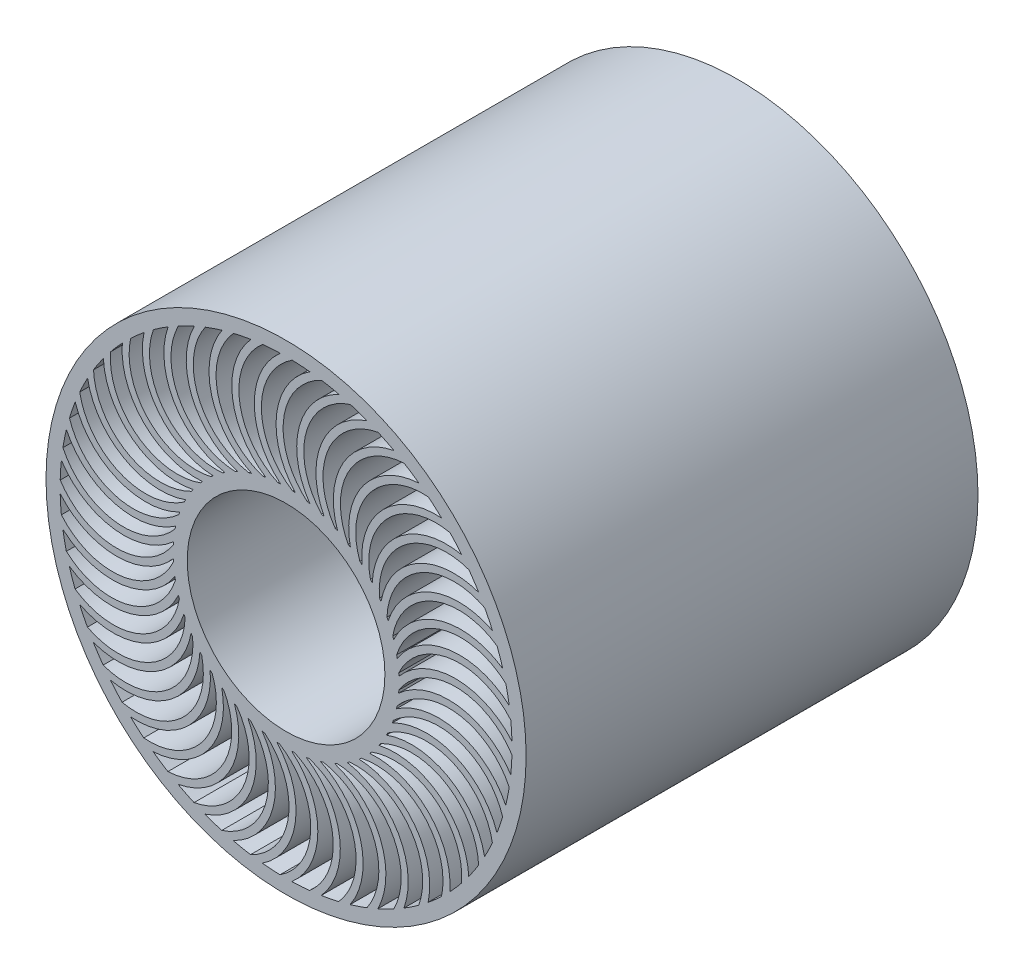
from build123d import *

# Parameters (mm, degrees)
SKETCH1_R           = 107.95
SKETCH1_R_2         = 44.45
BOSS_EXTRUDE1_DEPTH = 203.2


with BuildPart() as part:
    # Sketch1 → Boss-Extrude1 (new body)
    with BuildSketch(Plane.XY):
        Circle(SKETCH1_R)
        with BuildLine():
            ThreePointArc((2.914031468, 50.716352596), (-11.111338955, 76.088304157), (2.725745464, 101.563429992))
            ThreePointArc((2.725745464, 101.563429992), (6.717370348, 101.377694468), (10.698604394, 101.035141728))
            ThreePointArc((10.698604394, 101.035141728), (-4.227519557, 77.34168725), (4.172805013, 50.62832901))
            ThreePointArc((4.172805013, 50.62832901), (3.543691559, 50.676249369), (2.914031468, 50.716352596))
        make_face(mode=Mode.SUBTRACT)
        with BuildLine():
            ThreePointArc((-2.58065598, 101.567220178), (-14.286468478, 76.128216363), (-2.471216917, 50.739856986))
            ThreePointArc((-2.471216917, 50.739856986), (-3.10120308, 50.705251596), (-3.730710863, 50.6628246))
            ThreePointArc((-3.730710863, 50.6628246), (-20.947796524, 73.987037403), (-10.554261452, 101.050321945))
            ThreePointArc((-10.554261452, 101.050321945), (-6.572542121, 101.387187011), (-2.58065598, 101.567220178))
        make_face(mode=Mode.SUBTRACT)
        with BuildLine():
            ThreePointArc((-15.815760615, 100.361455331), (-24.100971962, 73.612170588), (-9.07295564, 49.983211941))
            ThreePointArc((-9.07295564, 49.983211941), (-9.693035274, 49.866672911), (-10.311619697, 49.742441629))
            ThreePointArc((-10.311619697, 49.742441629), (-30.425831487, 70.619831925), (-23.653682028, 98.808214874))
            ThreePointArc((-23.653682028, 98.808214874), (-19.749996573, 99.661916675), (-15.815760615, 100.361455331))
        make_face(mode=Mode.SUBTRACT)
        with BuildLine():
            ThreePointArc((-28.7802532, 97.438478158), (-33.503101134, 69.836600165), (-15.519453576, 48.371340282))
            ThreePointArc((-15.519453576, 48.371340282), (-16.119016947, 48.174861626), (-16.716093858, 47.970951691))
            ThreePointArc((-16.716093858, 47.970951691), (-39.383272037, 66.044301544), (-36.348381547, 94.875471851))
            ThreePointArc((-36.348381547, 94.875471851), (-32.589523107, 96.231403313), (-28.7802532, 97.438478158))
        make_face(mode=Mode.SUBTRACT)
        with BuildLine():
            ThreePointArc((-41.252307674, 92.848301608), (-42.331982957, 64.866106151), (-21.700409359, 45.93182158))
            ThreePointArc((-21.700409359, 45.93182158), (-22.269197772, 45.658765102), (-22.834551019, 45.378665469))
            ThreePointArc((-22.834551019, 45.378665469), (-47.666853884, 60.338734853), (-48.42115018, 89.3193832))
            ThreePointArc((-48.42115018, 89.3193832), (-44.871433866, 91.15434396), (-41.252307674, 92.848301608))
        make_face(mode=Mode.SUBTRACT)
        with BuildLine():
            ThreePointArc((-53.018523726, 86.669464876), (-50.436552814, 58.785735076), (-27.510065121, 42.706396676))
            ThreePointArc((-27.510065121, 42.706396676), (-28.038346448, 42.361434448), (-28.562302682, 42.0099377))
            ThreePointArc((-28.562302682, 42.0099377), (-55.134842645, 53.600755679), (-59.665419508, 82.235015139))
            ThreePointArc((-59.665419508, 82.235015139), (-56.38558195, 84.51760851), (-53.018523726, 86.669464876))
        make_face(mode=Mode.SUBTRACT)
        with BuildLine():
            ThreePointArc((-63.877578138, 79.00768957), (-57.678139269, 51.699523776), (-32.849016042, 38.750253484))
            ThreePointArc((-32.849016042, 38.750253484), (-33.327751243, 38.339287906), (-33.801345426, 37.922408249))
            ThreePointArc((-33.801345426, 37.922408249), (-61.659458962, 45.945652715), (-69.888796966, 73.743583169))
            ThreePointArc((-69.888796966, 73.743583169), (-66.934957094, 76.434753344), (-63.877578138, 79.00768957))
        make_face(mode=Mode.SUBTRACT)
        with BuildLine():
            ThreePointArc((-73.643669478, 69.994070791), (-63.93283677, 43.72871929), (-37.625911191, 34.131082711))
            ThreePointArc((-37.625911191, 34.131082711), (-38.046908973, 33.661145518), (-38.462037779, 33.186015879))
            ThreePointArc((-38.462037779, 33.186015879), (-67.129064841, 37.504406894), (-78.916357732, 63.990378045))
            ThreePointArc((-78.916357732, 63.990378045), (-76.339056565, 67.044078358), (-73.643669478, 69.994070791))
        make_face(mode=Mode.SUBTRACT)
        with BuildLine():
            ThreePointArc((-82.149697215, 59.782834054), (-69.093625709, 35.009704293), (-41.759016567, 28.927919651))
            ThreePointArc((-41.759016567, 28.927919651), (-42.115073543, 28.407051598), (-42.464634001, 27.881801576))
            ThreePointArc((-42.464634001, 27.881801576), (-71.450073808, 28.421450273), (-86.593637736, 53.142279812))
            ThreePointArc((-86.593637736, 53.142279812), (-84.436973612, 56.506260602), (-82.149697215, 59.782834054))
        make_face(mode=Mode.SUBTRACT)
        with BuildLine():
            ThreePointArc((-89.250120856, 48.548696452), (-73.072203555, 25.691663549), (-45.177613593, 23.229791865))
            ThreePointArc((-45.177613593, 23.229791865), (-45.462637528, 22.666905149), (-45.740648563, 22.100521919))
            ThreePointArc((-45.740648563, 22.100521919), (-74.548552204, 18.852194758), (-92.789276591, 41.384902437))
            ThreePointArc((-92.789276591, 41.384902437), (-91.090150631, 45.001605061), (-89.250120856, 48.548696452))
        make_face(mode=Mode.SUBTRACT)
        with BuildLine():
            ThreePointArc((-94.823450185, 36.483877193), (-75.800495738, 15.934031319), (-47.823209124, 17.134195899))
            ThreePointArc((-47.823209124, 17.134195899), (-48.03232318, 16.538921668), (-48.234027945, 15.941096203))
            ThreePointArc((-48.234027945, 15.941096203), (-76.371484202, 8.960372964), (-97.397265197, 28.919417907))
            ThreePointArc((-97.397265197, 28.919417907), (-96.184749917, 32.726959581), (-94.823450185, 36.483877193))
        make_face(mode=Mode.SUBTRACT)
        with BuildLine():
            ThreePointArc((-98.774323991, 23.79480868), (-77.231820424, 5.903763395), (-49.650536288, 10.745429091))
            ThreePointArc((-49.650536288, 10.745429091), (-49.780162465, 10.127952652), (-49.902109737, 9.508913912))
            ThreePointArc((-49.902109737, 9.508913912), (-76.887678931, -1.084763296), (-100.338759592, 15.959114119))
            ThreePointArc((-100.338759592, 15.959114119), (-99.633601465, 19.892346749), (-98.774323991, 23.79480868))
        make_face(mode=Mode.SUBTRACT)
        with BuildLine():
            ThreePointArc((-101.035141728, 10.698604394), (-77.34168725, -4.227519557), (-50.62832901, 4.172805013))
            ThreePointArc((-50.62832901, 4.172805013), (-50.676249369, 3.543691559), (-50.716352596, 2.914031468))
            ThreePointArc((-50.716352596, 2.914031468), (-76.088304157, -11.111338955), (-101.563429992, 2.725745464))
            ThreePointArc((-101.563429992, 2.725745464), (-101.377694468, 6.717370348), (-101.035141728, 10.698604394))
        make_face(mode=Mode.SUBTRACT)
        with BuildLine():
            ThreePointArc((-101.567220178, -2.58065598), (-76.128216363, -14.286468478), (-50.739856986, -2.471216917))
            ThreePointArc((-50.739856986, -2.471216917), (-50.705251596, -3.10120308), (-50.6628246, -3.730710863))
            ThreePointArc((-50.6628246, -3.730710863), (-73.987037403, -20.947796524), (-101.050321945, -10.554261452))
            ThreePointArc((-101.050321945, -10.554261452), (-101.387187011, -6.572542121), (-101.567220178, -2.58065598))
        make_face(mode=Mode.SUBTRACT)
        with BuildLine():
            ThreePointArc((-100.361455331, -15.815760615), (-73.612170588, -24.100971962), (-49.983211941, -9.07295564))
            ThreePointArc((-49.983211941, -9.07295564), (-49.866672911, -9.693035274), (-49.742441629, -10.311619697))
            ThreePointArc((-49.742441629, -10.311619697), (-70.619831925, -30.425831487), (-98.808214874, -23.653682028))
            ThreePointArc((-98.808214874, -23.653682028), (-99.661916675, -19.749996573), (-100.361455331, -15.815760615))
        make_face(mode=Mode.SUBTRACT)
        with BuildLine():
            ThreePointArc((-97.438478158, -28.7802532), (-69.836600165, -33.503101134), (-48.371340282, -15.519453576))
            ThreePointArc((-48.371340282, -15.519453576), (-48.174861626, -16.119016947), (-47.970951691, -16.716093858))
            ThreePointArc((-47.970951691, -16.716093858), (-66.044301544, -39.383272037), (-94.875471851, -36.348381547))
            ThreePointArc((-94.875471851, -36.348381547), (-96.231403313, -32.589523107), (-97.438478158, -28.7802532))
        make_face(mode=Mode.SUBTRACT)
        with BuildLine():
            ThreePointArc((-92.848301608, -41.252307674), (-64.866106151, -42.331982957), (-45.93182158, -21.700409359))
            ThreePointArc((-45.93182158, -21.700409359), (-45.658765102, -22.269197772), (-45.378665469, -22.834551019))
            ThreePointArc((-45.378665469, -22.834551019), (-60.338734853, -47.666853884), (-89.3193832, -48.42115018))
            ThreePointArc((-89.3193832, -48.42115018), (-91.15434396, -44.871433866), (-92.848301608, -41.252307674))
        make_face(mode=Mode.SUBTRACT)
        with BuildLine():
            ThreePointArc((-86.669464876, -53.018523726), (-58.785735076, -50.436552814), (-42.706396676, -27.510065121))
            ThreePointArc((-42.706396676, -27.510065121), (-42.361434448, -28.038346448), (-42.0099377, -28.562302682))
            ThreePointArc((-42.0099377, -28.562302682), (-53.600755679, -55.134842645), (-82.235015139, -59.665419508))
            ThreePointArc((-82.235015139, -59.665419508), (-84.51760851, -56.38558195), (-86.669464876, -53.018523726))
        make_face(mode=Mode.SUBTRACT)
        with BuildLine():
            ThreePointArc((-79.00768957, -63.877578138), (-51.699523776, -57.678139269), (-38.750253484, -32.849016042))
            ThreePointArc((-38.750253484, -32.849016042), (-38.339287906, -33.327751243), (-37.922408249, -33.801345426))
            ThreePointArc((-37.922408249, -33.801345426), (-45.945652715, -61.659458962), (-73.743583169, -69.888796966))
            ThreePointArc((-73.743583169, -69.888796966), (-76.434753344, -66.934957094), (-79.00768957, -63.877578138))
        make_face(mode=Mode.SUBTRACT)
        with BuildLine():
            ThreePointArc((-69.994070791, -73.643669478), (-43.72871929, -63.93283677), (-34.131082711, -37.625911191))
            ThreePointArc((-34.131082711, -37.625911191), (-33.661145518, -38.046908973), (-33.186015879, -38.462037779))
            ThreePointArc((-33.186015879, -38.462037779), (-37.504406894, -67.129064841), (-63.990378045, -78.916357732))
            ThreePointArc((-63.990378045, -78.916357732), (-67.044078358, -76.339056565), (-69.994070791, -73.643669478))
        make_face(mode=Mode.SUBTRACT)
        with BuildLine():
            ThreePointArc((-59.782834054, -82.149697215), (-35.009704293, -69.093625709), (-28.927919651, -41.759016567))
            ThreePointArc((-28.927919651, -41.759016567), (-28.407051598, -42.115073543), (-27.881801576, -42.464634001))
            ThreePointArc((-27.881801576, -42.464634001), (-28.421450273, -71.450073808), (-53.142279812, -86.593637736))
            ThreePointArc((-53.142279812, -86.593637736), (-56.506260602, -84.436973612), (-59.782834054, -82.149697215))
        make_face(mode=Mode.SUBTRACT)
        with BuildLine():
            ThreePointArc((-48.548696452, -89.250120856), (-25.691663549, -73.072203555), (-23.229791865, -45.177613593))
            ThreePointArc((-23.229791865, -45.177613593), (-22.666905149, -45.462637528), (-22.100521919, -45.740648563))
            ThreePointArc((-22.100521919, -45.740648563), (-18.852194758, -74.548552204), (-41.384902437, -92.789276591))
            ThreePointArc((-41.384902437, -92.789276591), (-45.001605061, -91.090150631), (-48.548696452, -89.250120856))
        make_face(mode=Mode.SUBTRACT)
        with BuildLine():
            ThreePointArc((-36.483877193, -94.823450185), (-15.934031319, -75.800495738), (-17.134195899, -47.823209124))
            ThreePointArc((-17.134195899, -47.823209124), (-16.538921668, -48.03232318), (-15.941096203, -48.234027945))
            ThreePointArc((-15.941096203, -48.234027945), (-8.960372964, -76.371484202), (-28.919417907, -97.397265197))
            ThreePointArc((-28.919417907, -97.397265197), (-32.726959581, -96.184749917), (-36.483877193, -94.823450185))
        make_face(mode=Mode.SUBTRACT)
        with BuildLine():
            ThreePointArc((-23.79480868, -98.774323991), (-5.903763395, -77.231820424), (-10.745429091, -49.650536288))
            ThreePointArc((-10.745429091, -49.650536288), (-10.127952652, -49.780162465), (-9.508913912, -49.902109737))
            ThreePointArc((-9.508913912, -49.902109737), (1.084763296, -76.887678931), (-15.959114119, -100.338759592))
            ThreePointArc((-15.959114119, -100.338759592), (-19.892346749, -99.633601465), (-23.79480868, -98.774323991))
        make_face(mode=Mode.SUBTRACT)
        with BuildLine():
            ThreePointArc((-10.698604394, -101.035141728), (4.227519557, -77.34168725), (-4.172805013, -50.62832901))
            ThreePointArc((-4.172805013, -50.62832901), (-3.543691559, -50.676249369), (-2.914031468, -50.716352596))
            ThreePointArc((-2.914031468, -50.716352596), (11.111338955, -76.088304157), (-2.725745464, -101.563429992))
            ThreePointArc((-2.725745464, -101.563429992), (-6.717370348, -101.377694468), (-10.698604394, -101.035141728))
        make_face(mode=Mode.SUBTRACT)
        with BuildLine():
            ThreePointArc((2.58065598, -101.567220178), (14.286468478, -76.128216363), (2.471216917, -50.739856986))
            ThreePointArc((2.471216917, -50.739856986), (3.10120308, -50.705251596), (3.730710863, -50.6628246))
            ThreePointArc((3.730710863, -50.6628246), (20.947796524, -73.987037403), (10.554261452, -101.050321945))
            ThreePointArc((10.554261452, -101.050321945), (6.572542121, -101.387187011), (2.58065598, -101.567220178))
        make_face(mode=Mode.SUBTRACT)
        with BuildLine():
            ThreePointArc((15.815760615, -100.361455331), (24.100971962, -73.612170588), (9.07295564, -49.983211941))
            ThreePointArc((9.07295564, -49.983211941), (9.693035274, -49.866672911), (10.311619697, -49.742441629))
            ThreePointArc((10.311619697, -49.742441629), (30.425831487, -70.619831925), (23.653682028, -98.808214874))
            ThreePointArc((23.653682028, -98.808214874), (19.749996573, -99.661916675), (15.815760615, -100.361455331))
        make_face(mode=Mode.SUBTRACT)
        with BuildLine():
            ThreePointArc((28.7802532, -97.438478158), (33.503101134, -69.836600165), (15.519453576, -48.371340282))
            ThreePointArc((15.519453576, -48.371340282), (16.119016947, -48.174861626), (16.716093858, -47.970951691))
            ThreePointArc((16.716093858, -47.970951691), (39.383272037, -66.044301544), (36.348381547, -94.875471851))
            ThreePointArc((36.348381547, -94.875471851), (32.589523107, -96.231403313), (28.7802532, -97.438478158))
        make_face(mode=Mode.SUBTRACT)
        with BuildLine():
            ThreePointArc((41.252307674, -92.848301608), (42.331982957, -64.866106151), (21.700409359, -45.93182158))
            ThreePointArc((21.700409359, -45.93182158), (22.269197772, -45.658765102), (22.834551019, -45.378665469))
            ThreePointArc((22.834551019, -45.378665469), (47.666853884, -60.338734853), (48.42115018, -89.3193832))
            ThreePointArc((48.42115018, -89.3193832), (44.871433866, -91.15434396), (41.252307674, -92.848301608))
        make_face(mode=Mode.SUBTRACT)
        with BuildLine():
            ThreePointArc((53.018523726, -86.669464876), (50.436552814, -58.785735076), (27.510065121, -42.706396676))
            ThreePointArc((27.510065121, -42.706396676), (28.038346448, -42.361434448), (28.562302682, -42.0099377))
            ThreePointArc((28.562302682, -42.0099377), (55.134842645, -53.600755679), (59.665419508, -82.235015139))
            ThreePointArc((59.665419508, -82.235015139), (56.38558195, -84.51760851), (53.018523726, -86.669464876))
        make_face(mode=Mode.SUBTRACT)
        with BuildLine():
            ThreePointArc((63.877578138, -79.00768957), (57.678139269, -51.699523776), (32.849016042, -38.750253484))
            ThreePointArc((32.849016042, -38.750253484), (33.327751243, -38.339287906), (33.801345426, -37.922408249))
            ThreePointArc((33.801345426, -37.922408249), (61.659458962, -45.945652715), (69.888796966, -73.743583169))
            ThreePointArc((69.888796966, -73.743583169), (66.934957094, -76.434753344), (63.877578138, -79.00768957))
        make_face(mode=Mode.SUBTRACT)
        with BuildLine():
            ThreePointArc((73.643669478, -69.994070791), (63.93283677, -43.72871929), (37.625911191, -34.131082711))
            ThreePointArc((37.625911191, -34.131082711), (38.046908973, -33.661145518), (38.462037779, -33.186015879))
            ThreePointArc((38.462037779, -33.186015879), (67.129064841, -37.504406894), (78.916357732, -63.990378045))
            ThreePointArc((78.916357732, -63.990378045), (76.339056565, -67.044078358), (73.643669478, -69.994070791))
        make_face(mode=Mode.SUBTRACT)
        with BuildLine():
            ThreePointArc((82.149697215, -59.782834054), (69.093625709, -35.009704293), (41.759016567, -28.927919651))
            ThreePointArc((41.759016567, -28.927919651), (42.115073543, -28.407051598), (42.464634001, -27.881801576))
            ThreePointArc((42.464634001, -27.881801576), (71.450073808, -28.421450273), (86.593637736, -53.142279812))
            ThreePointArc((86.593637736, -53.142279812), (84.436973612, -56.506260602), (82.149697215, -59.782834054))
        make_face(mode=Mode.SUBTRACT)
        with BuildLine():
            ThreePointArc((89.250120856, -48.548696452), (73.072203555, -25.691663549), (45.177613593, -23.229791865))
            ThreePointArc((45.177613593, -23.229791865), (45.462637528, -22.666905149), (45.740648563, -22.100521919))
            ThreePointArc((45.740648563, -22.100521919), (74.548552204, -18.852194758), (92.789276591, -41.384902437))
            ThreePointArc((92.789276591, -41.384902437), (91.090150631, -45.001605061), (89.250120856, -48.548696452))
        make_face(mode=Mode.SUBTRACT)
        with BuildLine():
            ThreePointArc((94.823450185, -36.483877193), (75.800495738, -15.934031319), (47.823209124, -17.134195899))
            ThreePointArc((47.823209124, -17.134195899), (48.03232318, -16.538921668), (48.234027945, -15.941096203))
            ThreePointArc((48.234027945, -15.941096203), (76.371484202, -8.960372964), (97.397265197, -28.919417907))
            ThreePointArc((97.397265197, -28.919417907), (96.184749917, -32.726959581), (94.823450185, -36.483877193))
        make_face(mode=Mode.SUBTRACT)
        with BuildLine():
            ThreePointArc((98.774323991, -23.79480868), (77.231820424, -5.903763395), (49.650536288, -10.745429091))
            ThreePointArc((49.650536288, -10.745429091), (49.780162465, -10.127952652), (49.902109737, -9.508913912))
            ThreePointArc((49.902109737, -9.508913912), (76.887678931, 1.084763296), (100.338759592, -15.959114119))
            ThreePointArc((100.338759592, -15.959114119), (99.633601465, -19.892346749), (98.774323991, -23.79480868))
        make_face(mode=Mode.SUBTRACT)
        with BuildLine():
            ThreePointArc((101.035141728, -10.698604394), (77.34168725, 4.227519557), (50.62832901, -4.172805013))
            ThreePointArc((50.62832901, -4.172805013), (50.676249369, -3.543691559), (50.716352596, -2.914031468))
            ThreePointArc((50.716352596, -2.914031468), (76.088304157, 11.111338955), (101.563429992, -2.725745464))
            ThreePointArc((101.563429992, -2.725745464), (101.377694468, -6.717370348), (101.035141728, -10.698604394))
        make_face(mode=Mode.SUBTRACT)
        with BuildLine():
            ThreePointArc((101.567220178, 2.58065598), (76.128216363, 14.286468478), (50.739856986, 2.471216917))
            ThreePointArc((50.739856986, 2.471216917), (50.705251596, 3.10120308), (50.6628246, 3.730710863))
            ThreePointArc((50.6628246, 3.730710863), (73.987037403, 20.947796524), (101.050321945, 10.554261452))
            ThreePointArc((101.050321945, 10.554261452), (101.387187011, 6.572542121), (101.567220178, 2.58065598))
        make_face(mode=Mode.SUBTRACT)
        with BuildLine():
            ThreePointArc((100.361455331, 15.815760615), (73.612170588, 24.100971962), (49.983211941, 9.07295564))
            ThreePointArc((49.983211941, 9.07295564), (49.866672911, 9.693035274), (49.742441629, 10.311619697))
            ThreePointArc((49.742441629, 10.311619697), (70.619831925, 30.425831487), (98.808214874, 23.653682028))
            ThreePointArc((98.808214874, 23.653682028), (99.661916675, 19.749996573), (100.361455331, 15.815760615))
        make_face(mode=Mode.SUBTRACT)
        with BuildLine():
            ThreePointArc((97.438478158, 28.7802532), (69.836600165, 33.503101134), (48.371340282, 15.519453576))
            ThreePointArc((48.371340282, 15.519453576), (48.174861626, 16.119016947), (47.970951691, 16.716093858))
            ThreePointArc((47.970951691, 16.716093858), (66.044301544, 39.383272037), (94.875471851, 36.348381547))
            ThreePointArc((94.875471851, 36.348381547), (96.231403313, 32.589523107), (97.438478158, 28.7802532))
        make_face(mode=Mode.SUBTRACT)
        with BuildLine():
            ThreePointArc((92.848301608, 41.252307674), (64.866106151, 42.331982957), (45.93182158, 21.700409359))
            ThreePointArc((45.93182158, 21.700409359), (45.658765102, 22.269197772), (45.378665469, 22.834551019))
            ThreePointArc((45.378665469, 22.834551019), (60.338734853, 47.666853884), (89.3193832, 48.42115018))
            ThreePointArc((89.3193832, 48.42115018), (91.15434396, 44.871433866), (92.848301608, 41.252307674))
        make_face(mode=Mode.SUBTRACT)
        with BuildLine():
            ThreePointArc((86.669464876, 53.018523726), (58.785735076, 50.436552814), (42.706396676, 27.510065121))
            ThreePointArc((42.706396676, 27.510065121), (42.361434448, 28.038346448), (42.0099377, 28.562302682))
            ThreePointArc((42.0099377, 28.562302682), (53.600755679, 55.134842645), (82.235015139, 59.665419508))
            ThreePointArc((82.235015139, 59.665419508), (84.51760851, 56.38558195), (86.669464876, 53.018523726))
        make_face(mode=Mode.SUBTRACT)
        with BuildLine():
            ThreePointArc((79.00768957, 63.877578138), (51.699523776, 57.678139269), (38.750253484, 32.849016042))
            ThreePointArc((38.750253484, 32.849016042), (38.339287906, 33.327751243), (37.922408249, 33.801345426))
            ThreePointArc((37.922408249, 33.801345426), (45.945652715, 61.659458962), (73.743583169, 69.888796966))
            ThreePointArc((73.743583169, 69.888796966), (76.434753344, 66.934957094), (79.00768957, 63.877578138))
        make_face(mode=Mode.SUBTRACT)
        with BuildLine():
            ThreePointArc((69.994070791, 73.643669478), (43.72871929, 63.93283677), (34.131082711, 37.625911191))
            ThreePointArc((34.131082711, 37.625911191), (33.661145518, 38.046908973), (33.186015879, 38.462037779))
            ThreePointArc((33.186015879, 38.462037779), (37.504406894, 67.129064841), (63.990378045, 78.916357732))
            ThreePointArc((63.990378045, 78.916357732), (67.044078358, 76.339056565), (69.994070791, 73.643669478))
        make_face(mode=Mode.SUBTRACT)
        with BuildLine():
            ThreePointArc((59.782834054, 82.149697215), (35.009704293, 69.093625709), (28.927919651, 41.759016567))
            ThreePointArc((28.927919651, 41.759016567), (28.407051598, 42.115073543), (27.881801576, 42.464634001))
            ThreePointArc((27.881801576, 42.464634001), (28.421450273, 71.450073808), (53.142279812, 86.593637736))
            ThreePointArc((53.142279812, 86.593637736), (56.506260602, 84.436973612), (59.782834054, 82.149697215))
        make_face(mode=Mode.SUBTRACT)
        with BuildLine():
            ThreePointArc((48.548696452, 89.250120856), (25.691663549, 73.072203555), (23.229791865, 45.177613593))
            ThreePointArc((23.229791865, 45.177613593), (22.666905149, 45.462637528), (22.100521919, 45.740648563))
            ThreePointArc((22.100521919, 45.740648563), (18.852194758, 74.548552204), (41.384902437, 92.789276591))
            ThreePointArc((41.384902437, 92.789276591), (45.001605061, 91.090150631), (48.548696452, 89.250120856))
        make_face(mode=Mode.SUBTRACT)
        with BuildLine():
            ThreePointArc((36.483877193, 94.823450185), (15.934031319, 75.800495738), (17.134195899, 47.823209124))
            ThreePointArc((17.134195899, 47.823209124), (16.538921668, 48.03232318), (15.941096203, 48.234027945))
            ThreePointArc((15.941096203, 48.234027945), (8.960372964, 76.371484202), (28.919417907, 97.397265197))
            ThreePointArc((28.919417907, 97.397265197), (32.726959581, 96.184749917), (36.483877193, 94.823450185))
        make_face(mode=Mode.SUBTRACT)
        with BuildLine():
            ThreePointArc((23.79480868, 98.774323991), (5.903763395, 77.231820424), (10.745429091, 49.650536288))
            ThreePointArc((10.745429091, 49.650536288), (10.127952652, 49.780162465), (9.508913912, 49.902109737))
            ThreePointArc((9.508913912, 49.902109737), (-1.084763296, 76.887678931), (15.959114119, 100.338759592))
            ThreePointArc((15.959114119, 100.338759592), (19.892346749, 99.633601465), (23.79480868, 98.774323991))
        make_face(mode=Mode.SUBTRACT)
        Circle(SKETCH1_R_2, mode=Mode.SUBTRACT)
    extrude(amount=BOSS_EXTRUDE1_DEPTH)


solid = part.part
